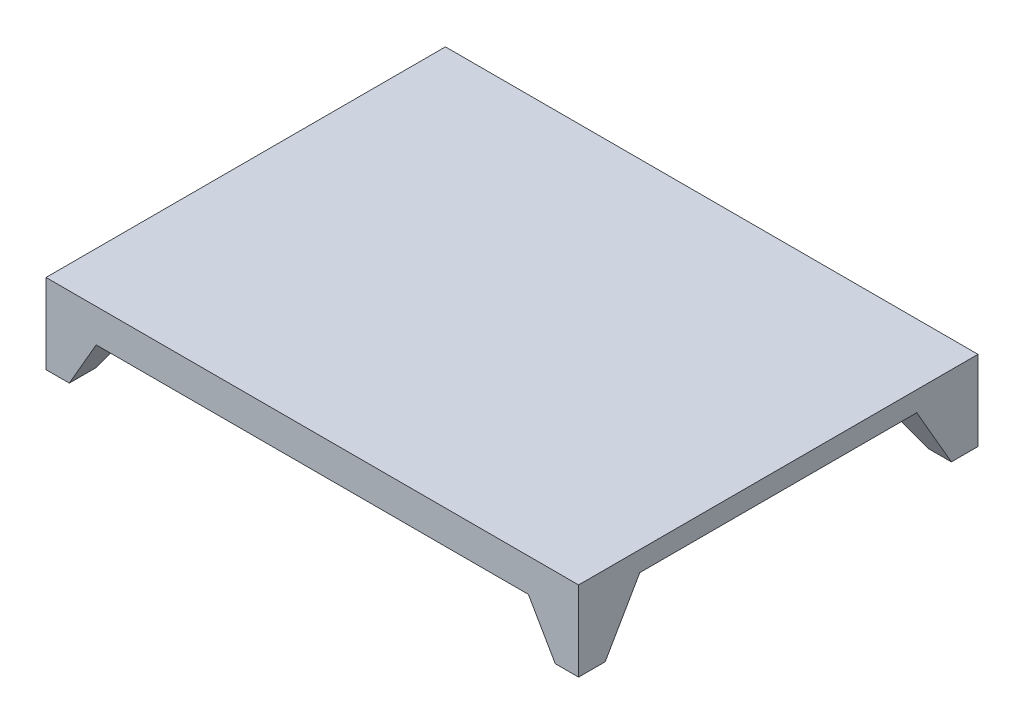
from build123d import *

# Parameters (mm, degrees)
CROQUIS1_W              = 800
CROQUIS1_H              = 120
SALIENTE_EXTRUIR1_DEPTH = 300
CORTAR_EXTRUIR1_DEPTH   = 857.504524215
CORTAR_EXTRUIR2_DEPTH   = 600


with BuildPart() as part:
    # Croquis1 → Saliente-Extruir1 (new, symmetric)
    with BuildSketch(Plane.XY):
        Rectangle(CROQUIS1_W, CROQUIS1_H)
    extrude(amount=SALIENTE_EXTRUIR1_DEPTH, both=True)

    # Croquis2 → Cortar-Extruir1 (cut, through all)
    with BuildSketch(Plane(origin=(400, 0, 0), x_dir=(0, 0, -1), z_dir=(1, 0, 0))):
        Polygon((-208.038475773, 30), (-260, -60), (0, -60), (0, 30), align=None)
        Polygon((0, 30), (0, -60), (260, -60), (208.038475773, 30), align=None)
    extrude(amount=-CORTAR_EXTRUIR1_DEPTH, mode=Mode.SUBTRACT)

    # Croquis3 → Cortar-Extruir2 (cut)
    with BuildSketch(Plane.XY.offset(300)):
        Polygon((-324.585481157, 10), (-365, -60), (0, -60), (0, 10), align=None)
        Polygon((0, 10), (0, -60), (365, -60), (324.585481157, 10), align=None)
    extrude(amount=-CORTAR_EXTRUIR2_DEPTH, mode=Mode.SUBTRACT)


solid = part.part
